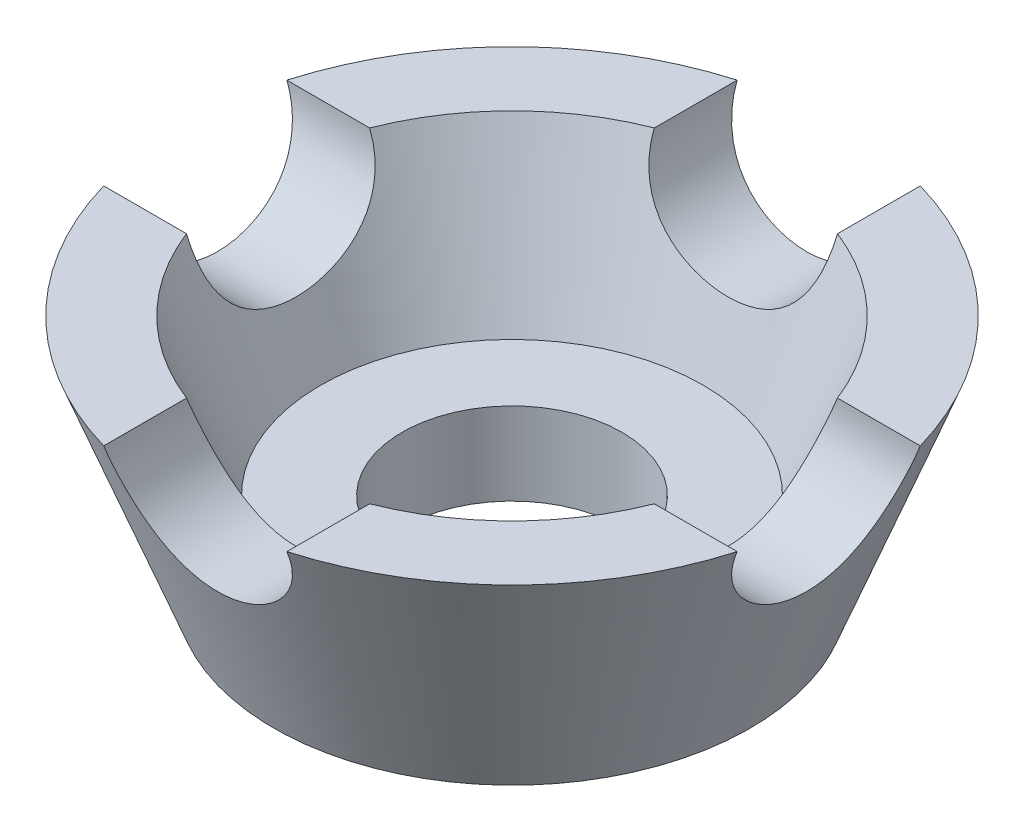
from build123d import *

# Parameters (mm, degrees)
CUT_EXTRUDE1_DEPTH      = 58.166423712
CUT_EXTRUDE1_DEPTH_BACK = 58.166423712
SKETCH11_R              = 10
CUT_EXTRUDE2_DEPTH      = 57.284989289
CUT_EXTRUDE2_DEPTH_BACK = 57.284989289
SKETCH12_R              = 10
SKETCH13_R              = 12
CUT_EXTRUDE3_DEPTH      = 26


with BuildPart() as part:
    # Sketch9 → Revolve2 (revolve)
    with BuildSketch(Plane.XY, mode=Mode.PRIVATE) as revolve2_sk:
        Polygon((0, 9), (0, 0), (26, 0), (36, 26), (27.428684137, 26), (20.890222599, 9), align=None)
    revolve(revolve2_sk.sketch.rotate(Axis((0, 0, 0), (0, 1, 0)), 90), axis=Axis((0, 0, 0), (0, 1, 0)))

    # Sketch11 → Cut-Extrude1 (cut, two sides: drawn at the far end of the back side and taken through both)
    with BuildSketch(Plane.XY.offset(-CUT_EXTRUDE1_DEPTH_BACK)):
        with Locations((0, 26)):
            Circle(SKETCH11_R)
    extrude(amount=CUT_EXTRUDE1_DEPTH + CUT_EXTRUDE1_DEPTH_BACK, mode=Mode.SUBTRACT)

    # Sketch12 → Cut-Extrude2 (cut, two sides: drawn at the far end of the back side and taken through both)
    with BuildSketch(Plane(origin=(0, 0, 0), x_dir=(0, 0, -1), z_dir=(1, 0, 0)).offset(-CUT_EXTRUDE2_DEPTH_BACK)):
        with Locations((0, 26)):
            Circle(SKETCH12_R)
    extrude(amount=CUT_EXTRUDE2_DEPTH + CUT_EXTRUDE2_DEPTH_BACK, mode=Mode.SUBTRACT)

    # Sketch13 → Cut-Extrude3 (cut)
    with BuildSketch(Plane(origin=(0, 9, 0), x_dir=(1, 0, 0), z_dir=(0, 1, 0))):
        with Locations(Location((0, 0, 0), (0, 0, 270))):
            Circle(SKETCH13_R)
    extrude(amount=-CUT_EXTRUDE3_DEPTH, mode=Mode.SUBTRACT)


solid = part.part
